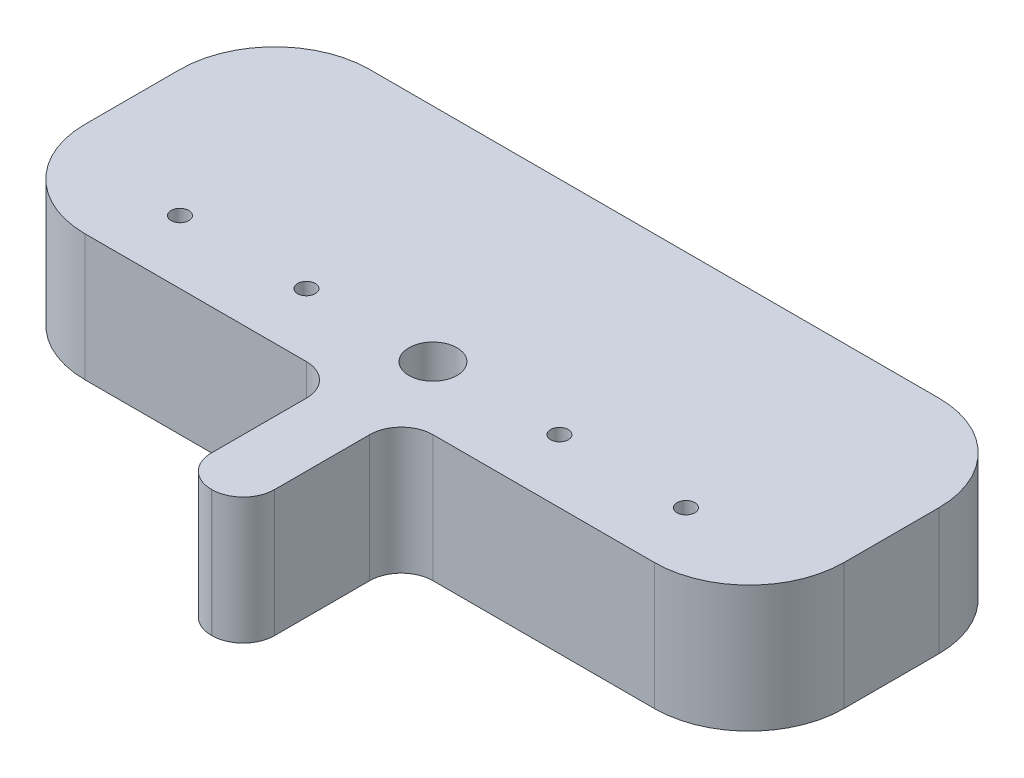
from build123d import *

# Parameters (mm, degrees)
SKETCH1_R           = 2.413
SKETCH1_R_2         = 0.889
BOSS_EXTRUDE1_DEPTH = 12.7


with BuildPart() as part:
    # Sketch1 → Boss-Extrude1 (new body)
    with BuildSketch(Plane(origin=(0, 0, 0), x_dir=(1, 0, 0), z_dir=(0, 1, 0))):
        with BuildLine():
            Line((-12.252777778, 4.097222222), (9.972222222, 4.097222222))
            ThreePointArc((9.972222222, 4.097222222), (12.217286252, 3.167286252), (13.147222222, 0.922222222))
            Line((13.147222222, 0.922222222), (13.147222222, -8.628177778))
            ThreePointArc((13.147222222, -8.628177778), (14.069718704, -10.855281296), (16.296822222, -11.777777778))
            Line((16.296822222, -11.777777778), (16.347622222, -11.777777778))
            ThreePointArc((16.347622222, -11.777777778), (18.57472574, -10.855281296), (19.497222222, -8.628177778))
            Line((19.497222222, -8.628177778), (19.497222222, 0.922222222))
            ThreePointArc((19.497222222, 0.922222222), (20.427158192, 3.167286252), (22.672222222, 4.097222222))
            Line((22.672222222, 4.097222222), (44.897222222, 4.097222222))
            ThreePointArc((44.897222222, 4.097222222), (51.632414313, 6.887030131), (54.422222222, 13.622222222))
            Line((54.422222222, 13.622222222), (54.422222222, 23.147222222))
            ThreePointArc((54.422222222, 23.147222222), (51.632414313, 29.882414313), (44.897222222, 32.672222222))
            Line((44.897222222, 32.672222222), (-12.252777778, 32.672222222))
            ThreePointArc((-12.252777778, 32.672222222), (-18.987969869, 29.882414313), (-21.777777778, 23.147222222))
            Line((-21.777777778, 23.147222222), (-21.777777778, 13.622222222))
            ThreePointArc((-21.777777778, 13.622222222), (-18.987969869, 6.887030131), (-12.252777778, 4.097222222))
        make_face()
        with Locations(Location((16.322222222, 10.447222222, 0), (0, 0, 270))):
            Circle(SKETCH1_R, mode=Mode.SUBTRACT)
        with Locations(Location((29.022222222, 10.447222222, 0), (0, 0, 270))):
            Circle(SKETCH1_R_2, mode=Mode.SUBTRACT)
        with Locations(Location((3.622222222, 10.447222222, 0), (0, 0, 270))):
            Circle(SKETCH1_R_2, mode=Mode.SUBTRACT)
        with Locations(Location((-9.077777778, 10.447222222, 0), (0, 0, 270))):
            Circle(SKETCH1_R_2, mode=Mode.SUBTRACT)
        with Locations(Location((41.722222222, 10.447222222, 0), (0, 0, 270))):
            Circle(SKETCH1_R_2, mode=Mode.SUBTRACT)
    extrude(amount=BOSS_EXTRUDE1_DEPTH)


solid = part.part
